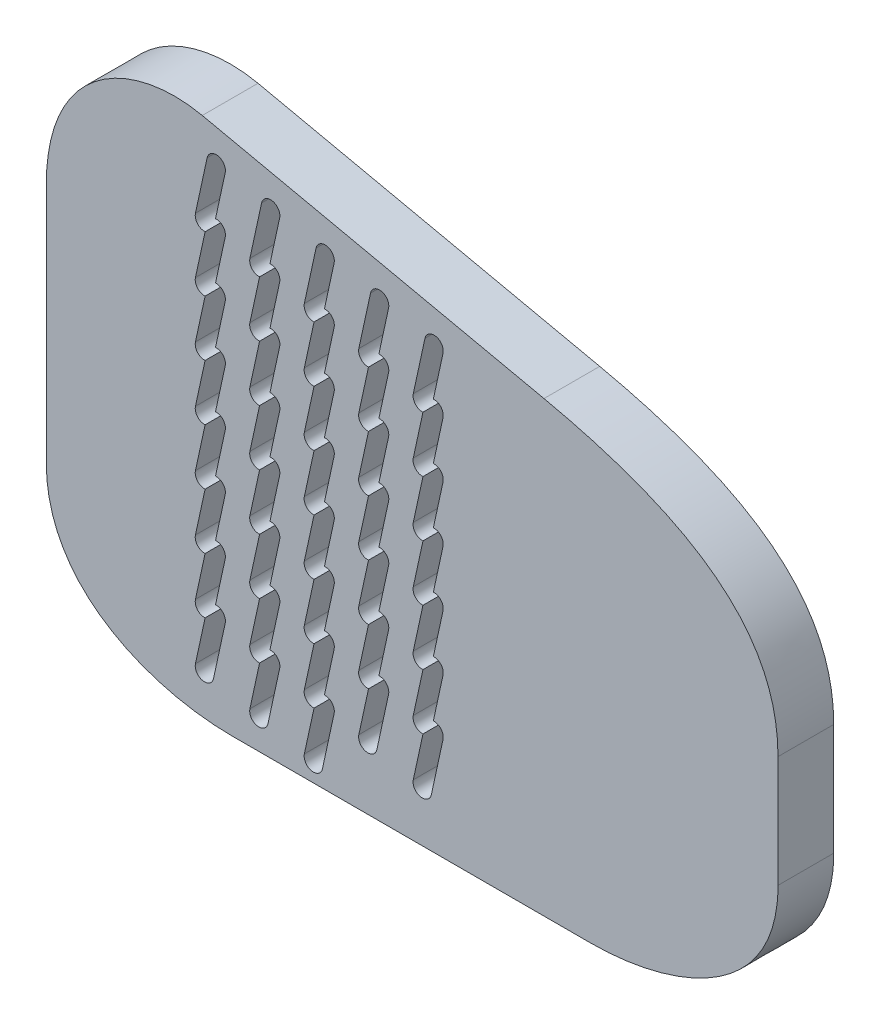
from build123d import *

# Parameters (mm, degrees)
EXTRUDE_1_DEPTH             = 10
CUT_EXTRUDE_1_DEPTH         = 149.427210809
PATTERN_LINEAR_1_COUNT      = 5
PATTERN_LINEAR_1_PITCH      = 10
PATTERN_LINEAR_1_COUNT_DIR2 = 9
PATTERN_LINEAR_1_PITCH_DIR2 = 10


with BuildPart() as part:
    # Эскиз1_fr → Бобышка-Вытянуть1 (new body)
    with BuildSketch(Plane.XY):
        with BuildLine():
            Line((0, 0), (0, 20))
            add(Edge.make_bspline(
                [(0, 20), (0, 38.146025899), (-14.209474182, 48.611098897), (-41.986949672, 54.649680525)],
                knots=[0, 0, 0, 0, 1, 1, 1, 1], degree=3))
            Line((-41.986949672, 54.649680525), (-103.301225383, 67.978870897))
            add(Edge.make_bspline(
                [(-103.301225383, 67.978870897), (-115.500001367, 70.63077872), (-131.292525164, 63.393306184), (-131.292525164, 43.097715536)],
                knots=[0, 0, 0, 0, 1, 1, 1, 1], degree=3))
            Line((-131.292525164, 43.097715536), (-131.292525164, 0))
            add(Edge.make_bspline(
                [(-97.969549234, -25.769768053), (-112.011160689, -25.769768053), (-131.292525164, -19.025155818), (-131.292525164, 0)],
                knots=[0, 0, 0, 0, 1, 1, 1, 1], degree=3))
            Line((-97.969549234, -25.769768053), (-33.545129103, -25.769768053))
            add(Edge.make_bspline(
                [(-33.545129103, -25.769768053), (-19.444866568, -25.769768053), (0, -19.063757455), (0, 0)],
                knots=[0, 0, 0, 0, 1, 1, 1, 1], degree=3))
        make_face()
    extrude(amount=EXTRUDE_1_DEPTH)

    # Эскиз2_fr → Вырез-Вытянуть1 (cut, through all)
    with BuildSketch(Plane(origin=(0, 0, 0), x_dir=(-1, 0, 0), z_dir=(0, 0, -1))):
        with BuildLine():
            Line((102.429251955, 61.832882372), (104.527789693, 52.179608775))
            ThreePointArc((104.527789693, 52.179608775), (103.259303337, 50.206407776), (101.286102339, 51.474894133))
            Line((101.286102339, 51.474894133), (99.1875646, 61.128167729))
            ThreePointArc((99.1875646, 61.128167729), (100.456050956, 63.101368728), (102.429251955, 61.832882372))
        make_face()
    cut_extrude_1 = extrude(amount=-CUT_EXTRUDE_1_DEPTH, mode=Mode.SUBTRACT)

    # Линейный массив1: Cut-Extrude 1 5 × 9, 7 skipped
    with Locations(*[Vector(0.9771763639228009, -0.21242964433104386, 0) * (i * PATTERN_LINEAR_1_PITCH) + Vector(0, -1, 0) * (j * PATTERN_LINEAR_1_PITCH_DIR2) for i in range(PATTERN_LINEAR_1_COUNT) for j in range(PATTERN_LINEAR_1_COUNT_DIR2) if (i, j) not in ((0, 0), (0, 8), (1, 8), (2, 8), (3, 7), (3, 8), (4, 7), (4, 8))]):
        add(cut_extrude_1, mode=Mode.SUBTRACT)


solid = part.part
